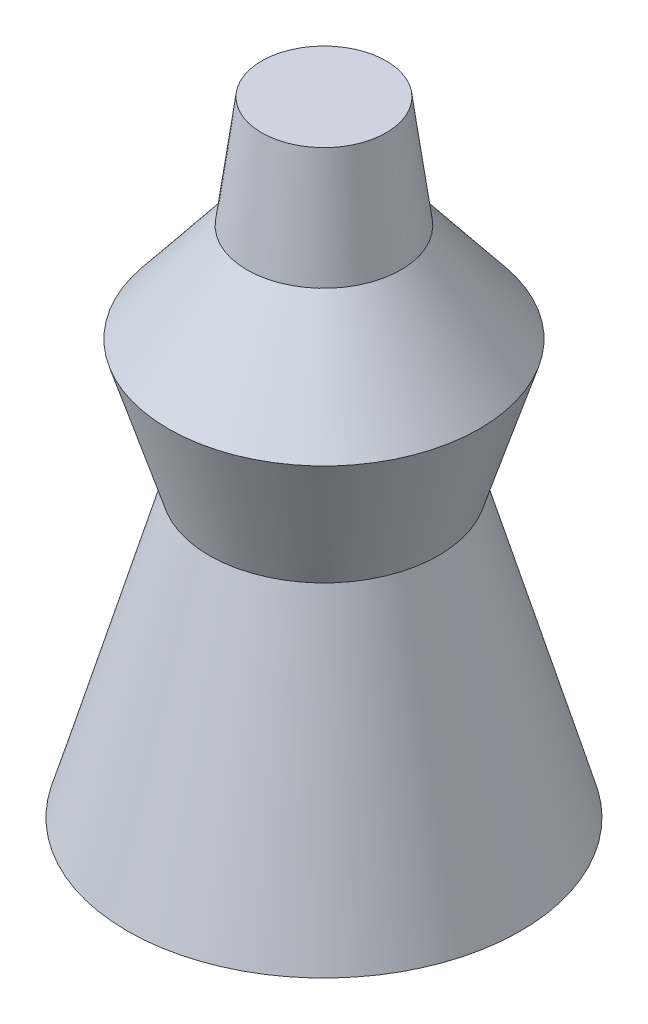
from build123d import *


with BuildPart() as part:
    # Sketch1 → Revolve1 (revolve)
    with BuildSketch(Plane.XY, mode=Mode.PRIVATE) as revolve1_sk:
        Polygon((0, 47.014591423), (0, -39.31099572), (27.189161305, -39.31099572), (15.860344094, 0), (21.5247527, 18.012819364), (10.649088178, 31.607400017), (8.60990108, 47.014591423), align=None)
    revolve(revolve1_sk.sketch.rotate(Axis((0, 47.014591423, 0), (0, -1, 0)), 90), axis=Axis((0, 47.014591423, 0), (0, -1, 0)))


solid = part.part
